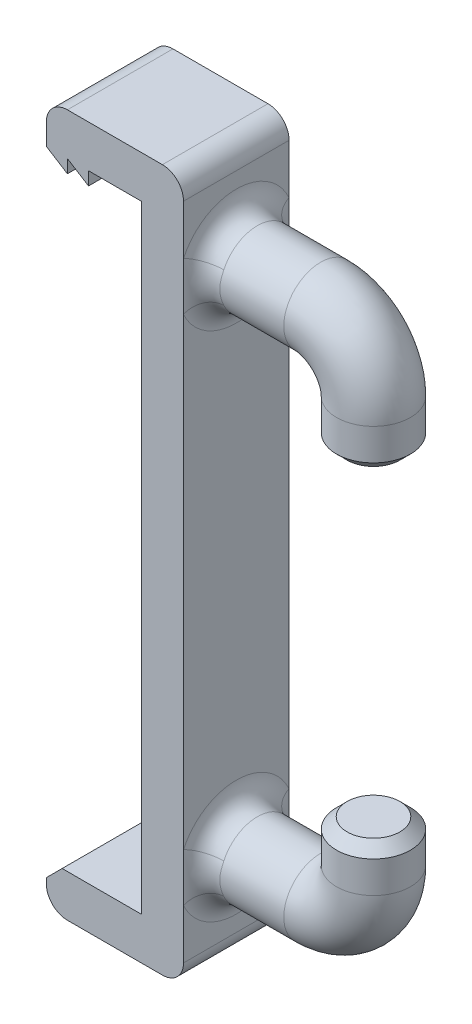
from build123d import *

# Parameters (mm, degrees)
BOSS_EXTRUDE1_DEPTH      = 10
SWEEP1_PROFILE_R         = 3.5
FILLET1_R                = 2
CHAMFER1_SIZE            = 1
FILLET1_OF_MIRROR1_R     = 2
CHAMFER1_OF_MIRROR1_SIZE = 1


with BuildPart() as part:
    # Sketch1 → Boss-Extrude1 (new body)
    with BuildSketch(Plane.XY):
        with BuildLine():
            Line((-13, 62.5), (-11, 61.25))
            Line((-11, 61.25), (-11, 62.5))
            Line((-11, 62.5), (-9, 61.25))
            Line((-9, 61.25), (-9, 62.5))
            Line((-9, 62.5), (-4, 62.5))
            Line((-4, 62.5), (-4, 4))
            Line((-4, 4), (-11.5, 4))
            Line((-11.5, 4), (-13, 2.5))
            Line((-13, 2.5), (-13, 2))
            ThreePointArc((-13, 2), (-12.414213562, 0.585786438), (-11, 0))
            Line((-11, 0), (-2, 0))
            ThreePointArc((-2, 0), (-0.585786438, 0.585786438), (0, 2))
            Line((0, 2), (0, 64.5))
            ThreePointArc((0, 64.5), (-0.585786438, 65.914213562), (-2, 66.5))
            Line((-2, 66.5), (-4, 66.5))
            Line((-4, 66.5), (-11, 66.5))
            ThreePointArc((-11, 66.5), (-12.414213562, 65.914213562), (-13, 64.5))
            Line((-13, 64.5), (-13, 62.5))
        make_face()
    extrude(amount=BOSS_EXTRUDE1_DEPTH)

    # Sweep1: sweep along a curve in space
    with BuildLine() as sweep1_path:
        Line((0, 9, 5), (8, 9, 5))
        ThreePointArc((8, 9, 5), (11.535533906, 10.464466094, 5), (13, 14, 5))
        Line((13, 14, 5), (13, 18, 5))
    # Sweep1 profile (on start of the path) → Sweep1 (sweep)
    with BuildSketch(Plane(origin=(0, 9, 5), x_dir=(0, 0, 1), z_dir=(1, 0, 0))):
        Circle(SWEEP1_PROFILE_R)
    sweep1 = sweep(path=sweep1_path.line)

    # Fillet1
    fillet1_edges = [part.edges().sort_by_distance(p)[0] for p in [
        (0, 9, 1.5),
    ]]
    fillet(fillet1_edges, radius=FILLET1_R)

    # Chamfer1
    chamfer1_edges = [part.edges().sort_by_distance(p)[0] for p in [
        (13, 18, 1.5),
    ]]
    chamfer(chamfer1_edges, length=CHAMFER1_SIZE)

    # Mirror1: Sweep1 across plane
    add(sweep1.mirror(Plane(origin=(0, 33.25, 0), x_dir=(0, 0, 1), z_dir=(0, -1, 0))))

    # Fillet1 of Mirror1
    fillet1_of_mirror1_edges = [part.edges().sort_by_distance(p)[0] for p in [
        (0, 57.5, 1.5),
    ]]
    fillet(fillet1_of_mirror1_edges, radius=FILLET1_OF_MIRROR1_R)

    # Chamfer1 of Mirror1
    chamfer1_of_mirror1_edges = [part.edges().sort_by_distance(p)[0] for p in [
        (13, 48.5, 1.5),
    ]]
    chamfer(chamfer1_of_mirror1_edges, length=CHAMFER1_OF_MIRROR1_SIZE)


solid = part.part
